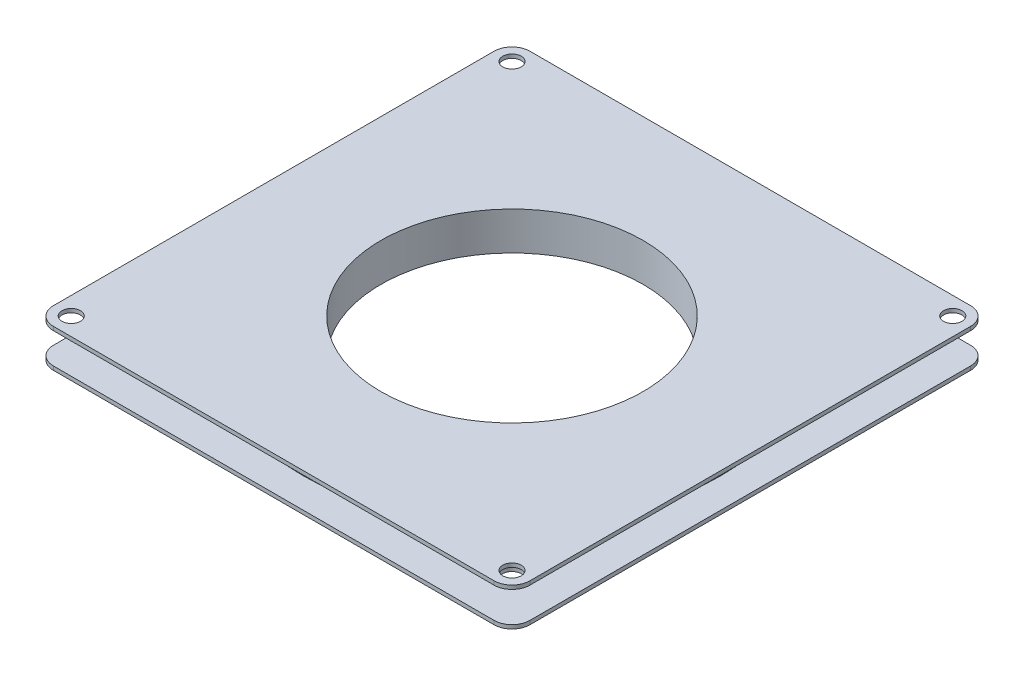
from build123d import *

# Parameters (mm, degrees)
LOWER_DECK_W        = 101.6
LOWER_DECK_H        = 101.6
LOWER_DECK_R        = 1.9685
LOWER_DECK_R_2      = 27.94
BOSS_EXTRUDE1_DEPTH = 0.8128
FILLET1_R           = 3.81
SKETCH2_W           = 101.6
SKETCH2_H           = 101.6
SKETCH2_R           = 27.94
SKETCH2_R_2         = 1.9685
BOSS_EXTRUDE2_DEPTH = 0.8128
FILLET3_R           = 3.81
BOSS_EXTRUDE3_REACH = 145.87
SKETCH3_R           = 44.45
SKETCH3_R_2         = 27.94


with BuildPart() as part:
    # Lower_Deck → Boss-Extrude1 (new body)
    with BuildSketch(Plane(origin=(0, 0, 0), x_dir=(1, 0, 0), z_dir=(0, 1, 0))):
        with Locations((50.8, 50.8)):
            Rectangle(LOWER_DECK_W, LOWER_DECK_H)
        with Locations(Location((10.3505, 10.3505, 0), (0, 0, 270))):
            Circle(LOWER_DECK_R, mode=Mode.SUBTRACT)
        with Locations(Location((10.3505, 91.2495, 0), (0, 0, 270))):
            Circle(LOWER_DECK_R, mode=Mode.SUBTRACT)
        with Locations(Location((91.2495, 10.3505, 0), (0, 0, 270))):
            Circle(LOWER_DECK_R, mode=Mode.SUBTRACT)
        with Locations(Location((91.2495, 91.2495, 0), (0, 0, 270))):
            Circle(LOWER_DECK_R, mode=Mode.SUBTRACT)
        with Locations(Location((50.8, 50.8, 0), (0, 0, 270))):
            Circle(LOWER_DECK_R_2, mode=Mode.SUBTRACT)
    extrude(amount=BOSS_EXTRUDE1_DEPTH)

    # Fillet1
    fillet1_edges = [part.edges().sort_by_distance(p)[0] for p in [
        (0, 0.4064, -101.6),
        (101.6, 0.4064, -101.6),
        (101.6, 0.4064, 0),
        (0, 0.4064, 0),
    ]]
    fillet(fillet1_edges, radius=FILLET1_R)


with BuildPart() as body_2:
    # Sketch2 → Boss-Extrude2 (new body)
    with BuildSketch(Plane(origin=(0, 7.3152, 0), x_dir=(1, 0, 0), z_dir=(0, 1, 0))):
        with Locations((50.8, 50.8)):
            Rectangle(SKETCH2_W, SKETCH2_H)
        with Locations(Location((50.8, 50.8, 0), (0, 0, 270))):
            Circle(SKETCH2_R, mode=Mode.SUBTRACT)
        with Locations(Location((3.81, 3.81, 0), (0, 0, 270))):
            Circle(SKETCH2_R_2, mode=Mode.SUBTRACT)
        with Locations(Location((3.81, 97.79, 0), (0, 0, 270))):
            Circle(SKETCH2_R_2, mode=Mode.SUBTRACT)
        with Locations(Location((97.79, 97.79, 0), (0, 0, 270))):
            Circle(SKETCH2_R_2, mode=Mode.SUBTRACT)
        with Locations(Location((97.79, 3.81, 0), (0, 0, 270))):
            Circle(SKETCH2_R_2, mode=Mode.SUBTRACT)
    extrude(amount=BOSS_EXTRUDE2_DEPTH)

    # Fillet3
    fillet3_edges = [body_2.edges().sort_by_distance(p)[0] for p in [
        (0, 7.7216, -101.6),
        (101.6, 7.7216, -101.6),
        (101.6, 7.7216, 0),
        (0, 7.7216, 0),
    ]]
    fillet(fillet3_edges, radius=FILLET3_R)

    # Sketch3 → Boss-Extrude3 (add, up to next)
    with BuildSketch(Plane(origin=(0, 0.8128, 0), x_dir=(1, 0, 0), z_dir=(0, 1, 0)), mode=Mode.PRIVATE) as boss_extrude3_sk1:
        with Locations(Location((50.8, 50.8, 0), (0, 0, 90))):
            Circle(SKETCH3_R)
        with Locations(Location((50.8, 50.8, 0), (0, 0, 270))):
            Circle(SKETCH3_R_2, mode=Mode.SUBTRACT)
    boss_extrude3_tool1 = extrude(boss_extrude3_sk1.sketch, amount=BOSS_EXTRUDE3_REACH, mode=Mode.PRIVATE) - body_2.part

    add(part.part)  # Boss-Extrude3 merges part
    add(boss_extrude3_tool1.solids().sort_by_distance((50.8, 0.8128, -7.607236))[0])


solid = body_2.part
